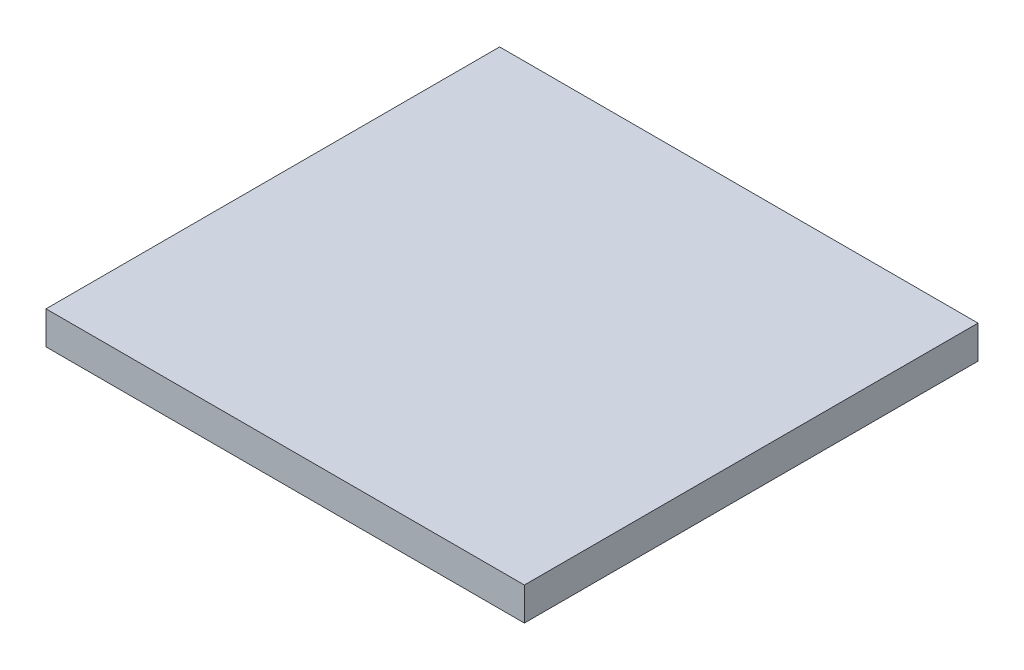
from build123d import *

# Parameters (mm, degrees)
OVEN_SICAK_DOLAP_PU_ALT_1_START = -30
SKETCH1_W                       = 580
SKETCH1_H                       = 40
OVEN_SICAK_DOLAP_PU_ALT_1_DEPTH = 550


with BuildPart() as part:
    # Sketch1 → OVEN_sicak_dolap_pu_alt_1 (new body)
    with BuildSketch(Plane.XY.offset(OVEN_SICAK_DOLAP_PU_ALT_1_START)):
        with Locations((350, 842)):
            Rectangle(SKETCH1_W, SKETCH1_H)
    extrude(amount=-OVEN_SICAK_DOLAP_PU_ALT_1_DEPTH)


solid = part.part
